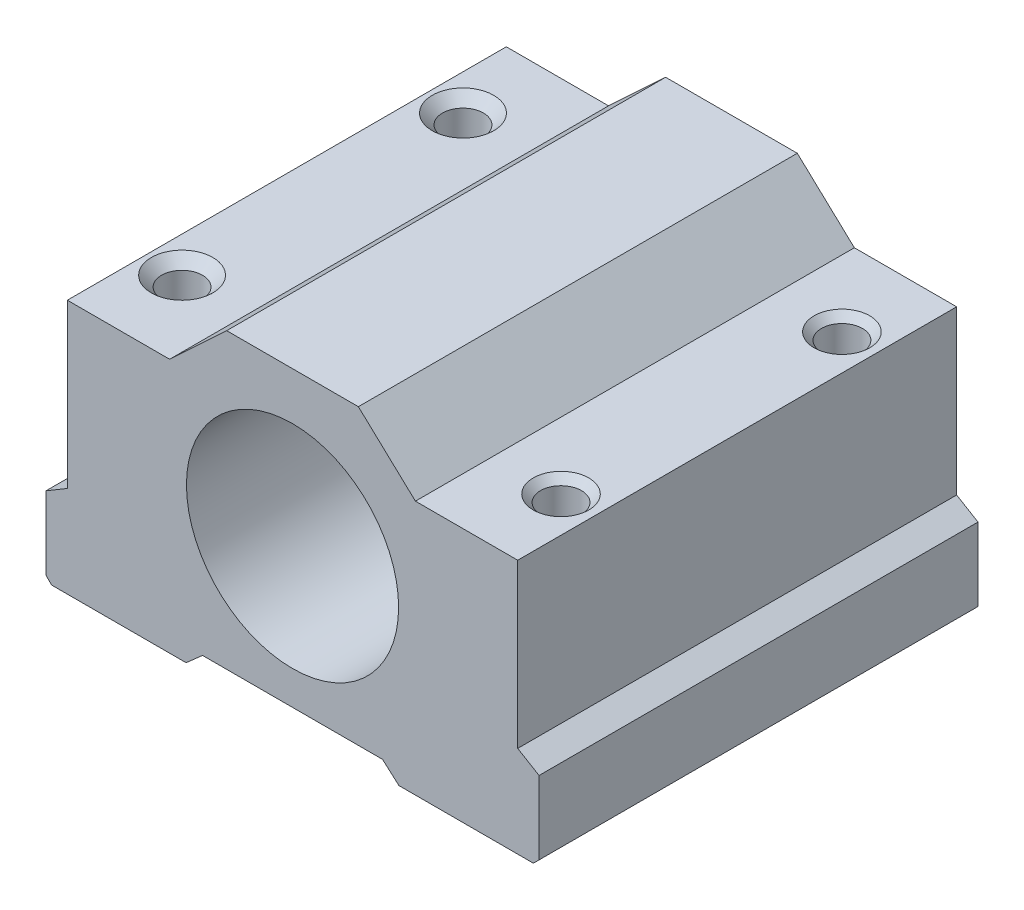
from build123d import *

# Parameters (mm, degrees)
CROQUIS1_R              = 7.25
SALIENTE_EXTRUIR1_DEPTH = 30
CROQUIS2_R              = 1.4
CORTAR_EXTRUIR1_DEPTH   = 41.332305418
CHAFL_N2_SIZE           = 0.85
CHAFL_N3_SIZE           = 0.7
CHAFL_N4_SIZE           = 0.5


with BuildPart() as part:
    # Croquis1 → Saliente-Extruir1 (new body)
    with BuildSketch(Plane.XY):
        Polygon((-15.39, 16.407843258), (-15.39, 5.26761363), (-16.85, 4.396751988), (-16.85, -0.603248012), (-16.46109127, -0.992156742), (-7.275, -0.992156742), (-6.15, 0), (6.15, 0), (7.275, -0.992156742), (16.46109127, -0.992156742), (16.85, -0.603248012), (16.85, 4.396751988), (15.39, 5.26761363), (15.39, 16.407843258), (8.4, 16.407843258), (4.5, 20.05), (-4.5, 20.05), (-8.4, 16.407843258), align=None)
        with Locations((0, 9.55)):
            Circle(CROQUIS1_R, mode=Mode.SUBTRACT)
    extrude(amount=-SALIENTE_EXTRUIR1_DEPTH)

    # Croquis2 → Cortar-Extruir1 (cut, through all)
    with BuildSketch(Plane.XZ.offset(0.992156742)):
        with Locations((-12.95, -5.4)):
            Circle(CROQUIS2_R)
        with Locations(Location((-12.95, -24.6, 0), (0, 0, 270))):
            Circle(CROQUIS2_R)
        with Locations((12.95, -24.6)):
            Circle(CROQUIS2_R)
        with Locations(Location((12.95, -5.4, 0), (0, 0, 90))):
            Circle(CROQUIS2_R)
    extrude(amount=-CORTAR_EXTRUIR1_DEPTH, mode=Mode.SUBTRACT)

    # Chaflán2
    chafl_n2_edges = [part.edges().sort_by_distance(p)[0] for p in [
        (12.95, -0.992156742, -6.8),
        (11.55, -0.992156742, -24.6),
        (-12.95, -0.992156742, -23.2),
        (-14.35, -0.992156742, -5.4),
    ]]
    chamfer(chafl_n2_edges, length=CHAFL_N2_SIZE)

    # Chaflán3
    chafl_n3_edges = [part.edges().sort_by_distance(p)[0] for p in [
        (-12.95, 16.407843258, -23.2),
        (-14.35, 16.407843258, -5.4),
    ]]
    chamfer(chafl_n3_edges, length=CHAFL_N3_SIZE)

    # Chaflán4
    chafl_n4_edges = [part.edges().sort_by_distance(p)[0] for p in [
        (12.95, 16.407843258, -6.8),
        (11.55, 16.407843258, -24.6),
    ]]
    chamfer(chafl_n4_edges, length=CHAFL_N4_SIZE)


solid = part.part
